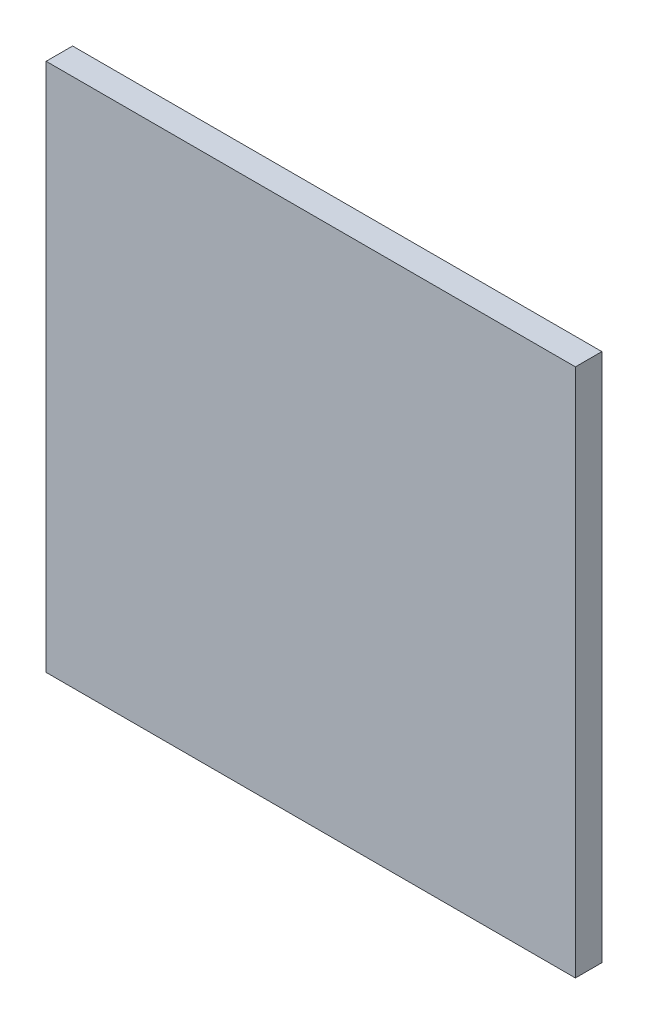
from build123d import *

# Parameters (mm, degrees)
SKETCH1_W           = 100
SKETCH1_H           = 100
BOSS_EXTRUDE1_DEPTH = 5


with BuildPart() as part:
    # Sketch1 → Boss-Extrude1 (new body)
    with BuildSketch(Plane.XY):
        with Locations((50, 50)):
            Rectangle(SKETCH1_W, SKETCH1_H)
    extrude(amount=BOSS_EXTRUDE1_DEPTH)


solid = part.part
